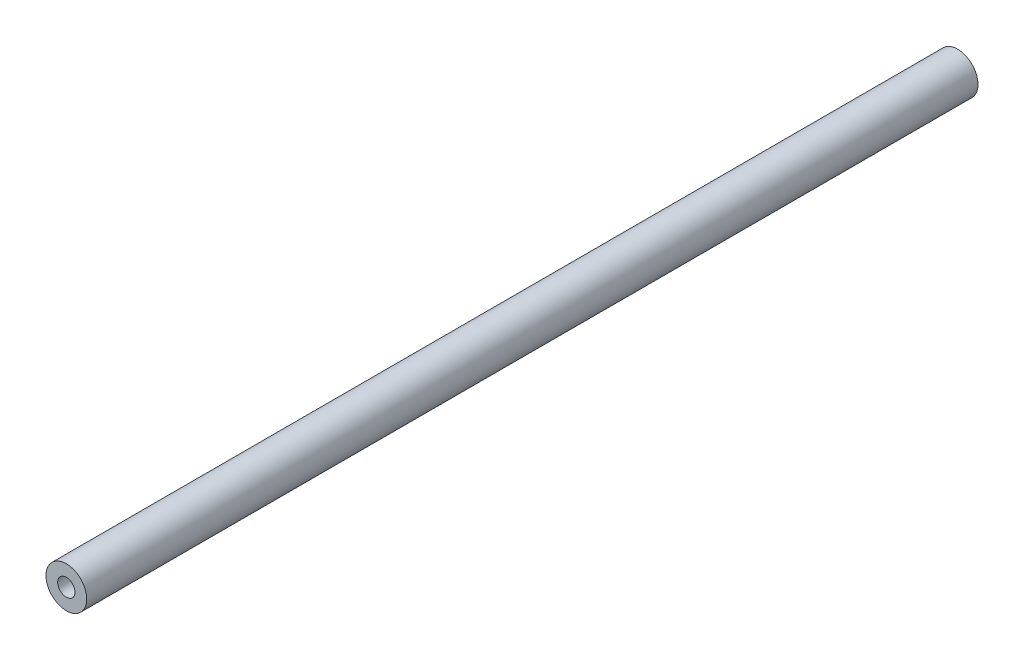
from build123d import *

# Parameters (mm, degrees)
SKETCH_1_R             = 8
EXTRUDE_1_DEPTH        = 350
HOLE_WIZARD_M8_2_D     = 6.8
HOLE_WIZARD_M8_2_DEPTH = 26.25
HOLE_WIZARD_M8_2_TIP   = 2.042926105


with BuildPart() as part:
    # 草图1 → 凸台-拉伸1 (new body)
    with BuildSketch(Plane.XY):
        Circle(SKETCH_1_R)
    extrude(amount=EXTRUDE_1_DEPTH)

    # 草图5 → M8 螺纹孔1 (revolve, cut)
    with BuildSketch(Plane(origin=(0, 0, 350), x_dir=(0, -1, 0), z_dir=(1, 0, 0))):
        Polygon((0, 0), (0, 28.292926105), (3.4, 26.25), (3.4, 0), align=None)
    revolve(axis=Axis((0, 0, 356.35), (0, 0, -1)), mode=Mode.SUBTRACT)

    # M8 螺纹孔2
    with Locations(Plane(origin=(0, 0, 0), x_dir=(-1, 0, 0), z_dir=(0, 0, -1))):
        with Locations((0, 0)):
            Hole(HOLE_WIZARD_M8_2_D / 2, depth=HOLE_WIZARD_M8_2_DEPTH)
            with Locations((0, 0, -(HOLE_WIZARD_M8_2_DEPTH + HOLE_WIZARD_M8_2_TIP / 2))):  # 118° drill point
                Cone(0, HOLE_WIZARD_M8_2_D / 2, HOLE_WIZARD_M8_2_TIP, mode=Mode.SUBTRACT)


solid = part.part
